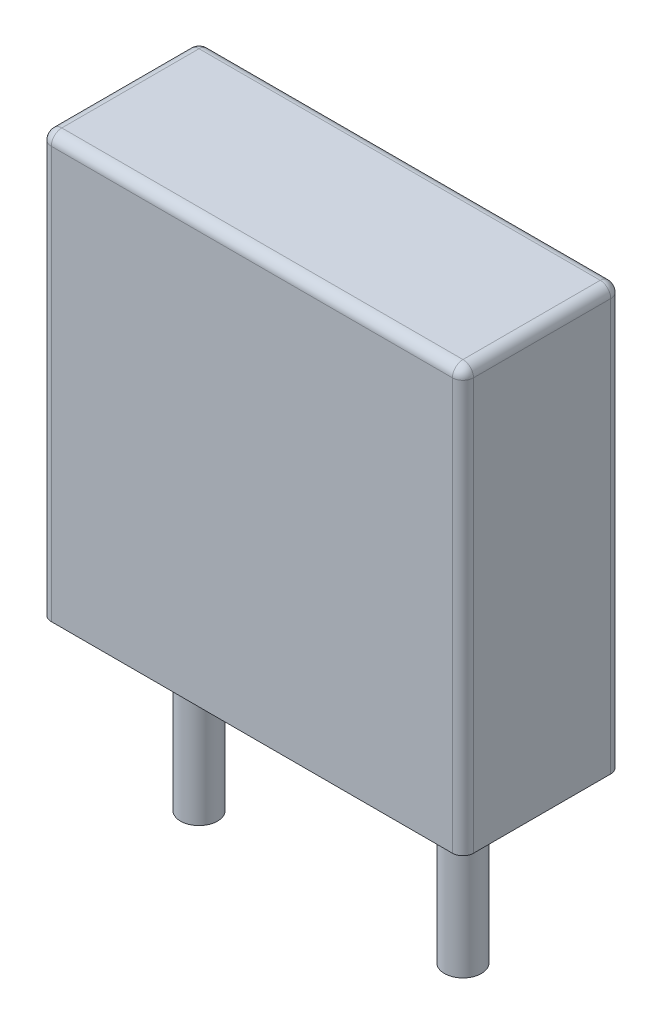
from build123d import *

# Parameters (mm, degrees)
SKETCH_1_W      = 8
SKETCH_1_H      = 3
EXTRUDE_1_DEPTH = 8
SKETCH_2_R      = 0.35
EXTRUDE_2_DEPTH = 3.2
FILLET_1_R      = 0.2


with BuildPart() as part:
    # Эскиз1 → Бобышка-Вытянуть1 (new body)
    with BuildSketch(Plane(origin=(0, 0, 0), x_dir=(1, 0, 0), z_dir=(0, 1, 0))):
        Rectangle(SKETCH_1_W, SKETCH_1_H)
    extrude(amount=EXTRUDE_1_DEPTH)

    # Эскиз2 → Бобышка-Вытянуть2 (add)
    with BuildSketch(Plane.XZ):
        with Locations(Location((-2.5, 0, 0), (0, 0, 270))):
            Circle(SKETCH_2_R)
        with Locations(Location((2.5, 0, 0), (0, 0, 270))):
            Circle(SKETCH_2_R)
    extrude(amount=EXTRUDE_2_DEPTH)

    # Скругление1
    fillet_1_edges = [part.edges().sort_by_distance(p)[0] for p in [
        (-4, 8, 0),
        (0, 8, 1.5),
        (4, 8, 0),
        (4, 4, 1.5),
        (-4, 4, 1.5),
        (-4, 4, -1.5),
        (4, 4, -1.5),
        (0, 8, -1.5),
    ]]
    fillet(fillet_1_edges, radius=FILLET_1_R)


solid = part.part
